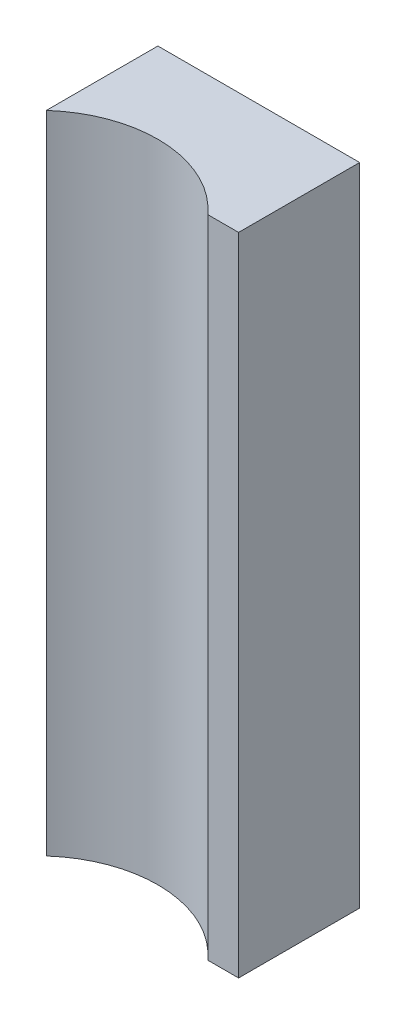
from build123d import *

# Parameters (mm, degrees)
BOSS_EXTRUDE1_DEPTH = 101.6


with BuildPart() as part:
    # Sketch2 → Boss-Extrude1 (new body)
    with BuildSketch(Plane(origin=(0, 0, 0), x_dir=(1, 0, 0), z_dir=(0, 1, 0))):
        with BuildLine():
            Line((19.05, 12.7), (19.05, 31.75))
            Line((19.05, 31.75), (-12.7, 31.75))
            Line((-12.7, 31.75), (-12.7, 14.199031657))
            ThreePointArc((-12.7, 14.199031657), (1.05997545, 19.020487692), (14.199031657, 12.7))
            Line((14.199031657, 12.7), (19.05, 12.7))
        make_face()
    extrude(amount=BOSS_EXTRUDE1_DEPTH)


solid = part.part
